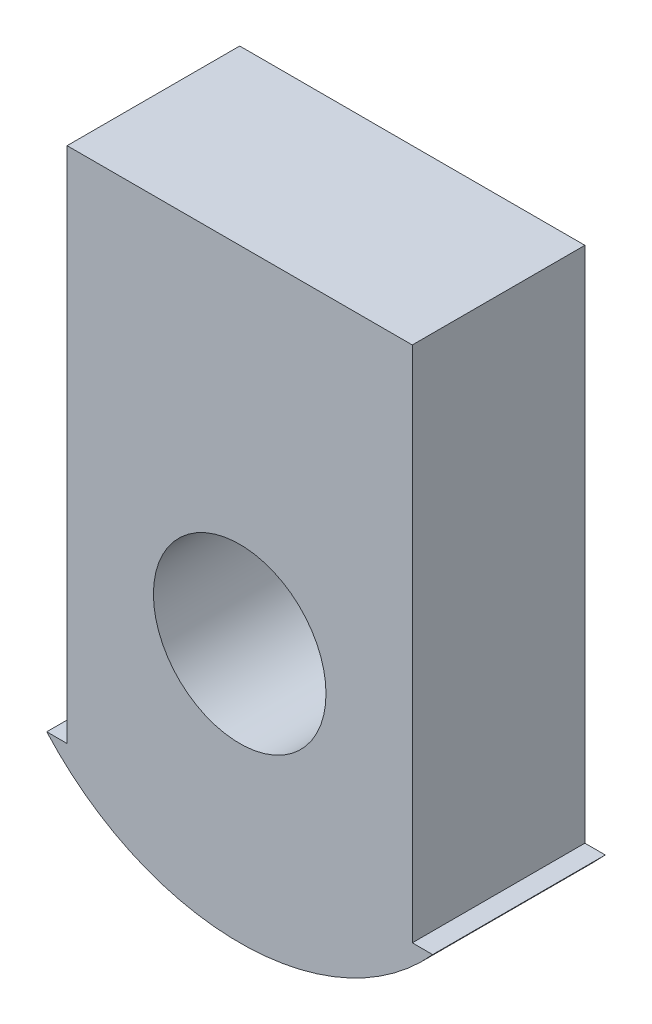
from build123d import *

# Parameters (mm, degrees)
CROQUIS1_R              = 2.5
SALIENTE_EXTRUIR1_DEPTH = 5


with BuildPart() as part:
    # Croquis1 → Saliente-Extruir1 (new body)
    with BuildSketch(Plane.XY):
        with BuildLine():
            Line((5, -5), (5.590169944, -5))
            ThreePointArc((5.590169944, -5), (0, -7.5), (-5.590169944, -5))
            Line((-5.590169944, -5), (-5, -5))
            Line((-5, -5), (-5, 5))
            Line((-5, 5), (-5, 10))
            Line((-5, 10), (5, 10))
            Line((5, 10), (5, 5))
            Line((5, 5), (5, -5))
        make_face()
        Circle(CROQUIS1_R, mode=Mode.SUBTRACT)
    extrude(amount=SALIENTE_EXTRUIR1_DEPTH)


solid = part.part
